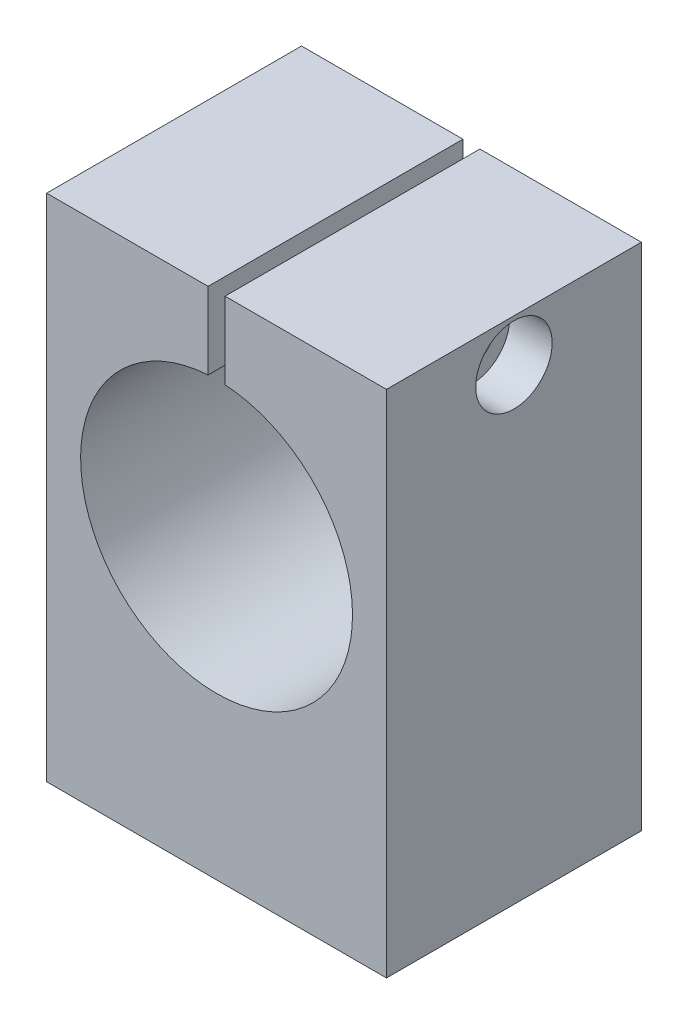
from build123d import *

# Parameters (mm, degrees)
SALIENTE_EXTRUIR1_DEPTH                              = 30
TALADRO_ROSCADO_M4X0_71_D                            = 3.3
TALADRO_ROSCADO_M4X0_71_DEPTH                        = 15
TALADRO_ROSCADO_M4X0_71_TIP                          = 0.991420021
REFRENTADO_PARA_TORNILLO_TAP_N_CON_CABEZ_D           = 5.3
REFRENTADO_PARA_TORNILLO_TAP_N_CON_CABEZ_CBORE_D     = 9
REFRENTADO_PARA_TORNILLO_TAP_N_CON_CABEZ_CBORE_DEPTH = 5
CROQUIS9_R                                           = 2.65
SALIENTE_EXTRUIR2_DEPTH                              = 19
TALADRO_ROSCADO_M5X0_82_D                            = 4.5


with BuildPart() as part:
    # Croquis1 → Saliente-Extruir1 (new body)
    with BuildSketch(Plane.XY):
        with BuildLine():
            Line((-20, -30), (20, -30))
            Line((20, -30), (20, 30))
            Line((20, 30), (1, 30))
            Line((1, 30), (1, 20.968719423))
            ThreePointArc((1, 20.968719423), (0, -11), (-1, 20.968719423))
            Line((-1, 20.968719423), (-1, 30))
            Line((-1, 30), (-20, 30))
            Line((-20, 30), (-20, -30))
        make_face()
    extrude(amount=SALIENTE_EXTRUIR1_DEPTH)

    # Taladro roscado M4x0.71
    with Locations(Plane(origin=(0, -30, 0), x_dir=(-1, 0, 0), z_dir=(0, -1, 0))):
        with Locations((-15, -5), (-15, -25), (15, -5), (15, -25)):
            Hole(TALADRO_ROSCADO_M4X0_71_D / 2, depth=TALADRO_ROSCADO_M4X0_71_DEPTH)
            with Locations((0, 0, -(TALADRO_ROSCADO_M4X0_71_DEPTH + TALADRO_ROSCADO_M4X0_71_TIP / 2))):  # 118° drill point
                Cone(0, TALADRO_ROSCADO_M4X0_71_D / 2, TALADRO_ROSCADO_M4X0_71_TIP, mode=Mode.SUBTRACT)

    # Refrentado para tornillo tapón con cabeza de clavija de M52 (through all)
    with Locations(Plane(origin=(20, 0, 0), x_dir=(0, 0, -1), z_dir=(1, 0, 0))):
        with Locations((-15, 25)):
            CounterBoreHole(REFRENTADO_PARA_TORNILLO_TAP_N_CON_CABEZ_D / 2, REFRENTADO_PARA_TORNILLO_TAP_N_CON_CABEZ_CBORE_D / 2, REFRENTADO_PARA_TORNILLO_TAP_N_CON_CABEZ_CBORE_DEPTH)

    # Croquis9 → Saliente-Extruir2 (add)
    with BuildSketch(Plane.ZY.offset(20)):
        with Locations(Location((15, 25, 0), (0, 0, 180))):
            Circle(CROQUIS9_R)
    extrude(amount=-SALIENTE_EXTRUIR2_DEPTH)

    # Taladro roscado M5x0.82 (through all)
    with Locations(Plane.ZY.offset(20)):
        with Locations((15, 25)):
            Hole(TALADRO_ROSCADO_M5X0_82_D / 2)


solid = part.part
